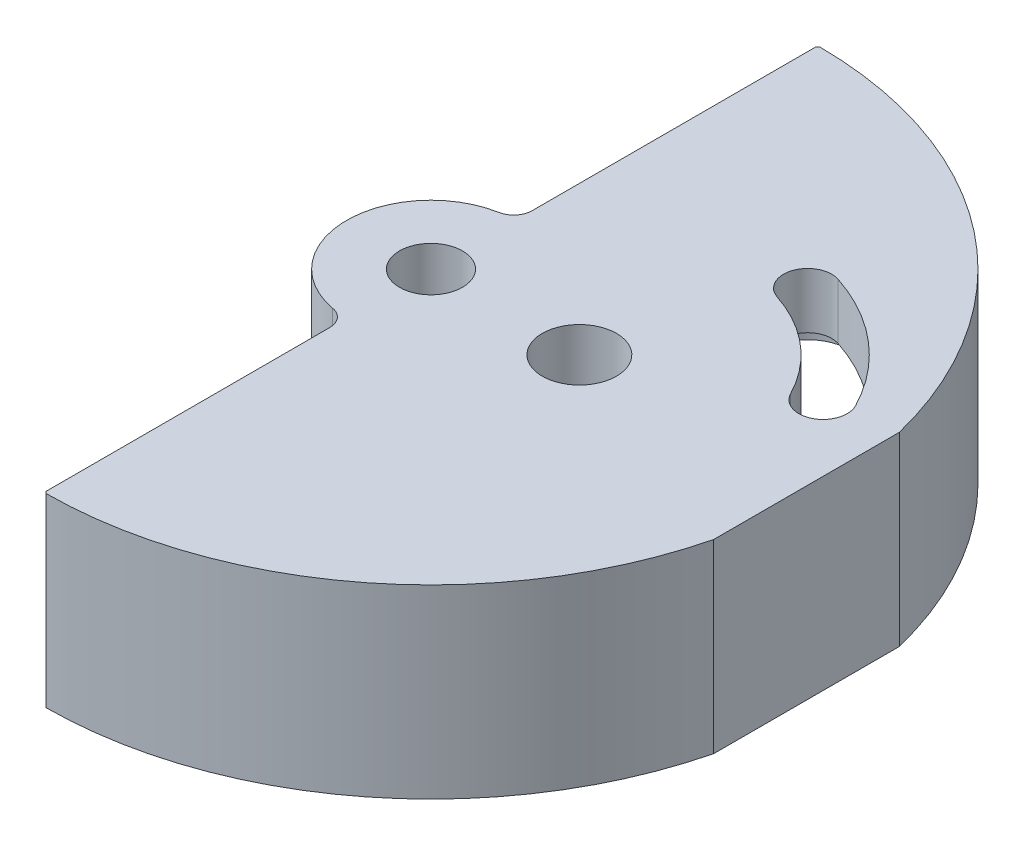
from build123d import *

# Parameters (mm, degrees)
SKETCH_1_R          = 6
EXTRUDE_1_DEPTH     = 20
SKETCH_2_R          = 6.1
EXTRUDE_2_DEPTH     = 11
SKETCH_3_R          = 3.4
CUT_EXTRUDE_1_DEPTH = 60.989832472
SKETCH_4_R          = 2.1
CUT_EXTRUDE_2_DEPTH = 10
CUT_EXTRUDE_3_DEPTH = 63.271823484
CUT_EXTRUDE_4_DEPTH = 12
SKETCH_7_R          = 6.5
CUT_EXTRUDE_5_DEPTH = 1
SKETCH_8_R          = 4
CUT_EXTRUDE_6_DEPTH = 60.554848669
CUT_EXTRUDE_7_DEPTH = 60.344586948
CUT_EXTRUDE_8_DEPTH = 2
CHAMFER_1_SIZE      = 0.2


with BuildPart() as part:
    # 草图1 → 凸台-拉伸1 (new body)
    with BuildSketch(Plane(origin=(0, 0, 0), x_dir=(1, 0, 0), z_dir=(0, 1, 0))):
        with BuildLine():
            Line((0, 41.7), (0, 10.918333206))
            ThreePointArc((0, 10.918333206), (-0.463653568, 9.637849063), (-1.63963964, 8.951065962))
            ThreePointArc((-1.63963964, 8.951065962), (-9.1, 0), (-1.63963964, -8.951065962))
            ThreePointArc((-1.63963964, -8.951065962), (-0.463653568, -9.637849063), (0, -10.918333206))
            Line((0, -10.918333206), (0, -41.7))
            ThreePointArc((0, -41.7), (41.7, 0), (0, 41.7))
        make_face()
        with Locations(Location((0, 0, 0), (0, 0, 270))):
            Circle(SKETCH_1_R, mode=Mode.SUBTRACT)
    extrude(amount=EXTRUDE_1_DEPTH)

    # 草图2 → 凸台-拉伸2 (add)
    with BuildSketch(Plane.XZ):
        Circle(SKETCH_2_R)
    extrude(amount=-EXTRUDE_2_DEPTH)

    # 草图3 → 切除-拉伸1 (cut, through all)
    with BuildSketch(Plane(origin=(0, 11, 0), x_dir=(1, 0, 0), z_dir=(0, 1, 0))):
        with Locations(Location((0, 0, 0), (0, 0, 270))):
            Circle(SKETCH_3_R)
    extrude(amount=-CUT_EXTRUDE_1_DEPTH, mode=Mode.SUBTRACT)

    # 草图4 → 切除-拉伸2 (cut)
    with BuildSketch(Plane.ZY):
        with Locations((33.667083302, 15)):
            Circle(SKETCH_4_R)
        with Locations((20.918333206, 10)):
            Circle(SKETCH_4_R)
        with Locations(Location((-33.667083302, 15, 0), (0, 0, 180))):
            Circle(SKETCH_4_R)
        with Locations(Location((-20.918333206, 10, 0), (0, 0, 180))):
            Circle(SKETCH_4_R)
    extrude(amount=-CUT_EXTRUDE_2_DEPTH, mode=Mode.SUBTRACT)


with BuildPart() as body_2:
    # 镜向1: mirrored copy
    add(part.part.mirror(Plane.ZX))

    # 草图5 → 切除-拉伸3 (cut, through all)
    with BuildSketch(Plane(origin=(0, 0, 0), x_dir=(1, 0, 0), z_dir=(0, 1, 0))):
        with BuildLine():
            Line((40.483206395, 10), (40.483206395, -10))
            ThreePointArc((40.483206395, -10), (41.394683878, -5.036878663), (41.7, 0))
            ThreePointArc((41.7, 0), (41.394683878, 5.036878663), (40.483206395, 10))
        make_face()
    extrude(amount=-CUT_EXTRUDE_3_DEPTH, mode=Mode.SUBTRACT)

    # 草图6 → 切除-拉伸4 (cut)
    with BuildSketch(Plane.XZ.offset(20)):
        with BuildLine():
            Line((6, -36.124783736), (6, -6.841783393))
            ThreePointArc((6, -6.841783393), (9.1, 0), (6, 6.841783393))
            Line((6, 6.841783393), (6, 36.124783736))
            ThreePointArc((6, 36.124783736), (6.747974614, 37.684409471), (8.432432432, 38.077474749))
            ThreePointArc((8.432432432, 38.077474749), (39, 0), (8.432432432, -38.077474749))
            ThreePointArc((8.432432432, -38.077474749), (6.747974614, -37.684409471), (6, -36.124783736))
        make_face()
    extrude(amount=-CUT_EXTRUDE_4_DEPTH, mode=Mode.SUBTRACT)

    # 草图7 → 切除-拉伸5 (cut)
    with BuildSketch(Plane.XZ.offset(8)):
        with Locations(Location((16, 0, 0), (0, 0, 270))):
            Circle(SKETCH_7_R)
    extrude(amount=-CUT_EXTRUDE_5_DEPTH, mode=Mode.SUBTRACT)

    # 草图8 → 切除-拉伸6 (cut, through all)
    with BuildSketch(Plane.XZ.offset(7)):
        with Locations(Location((16, 0, 0), (0, 0, 270))):
            Circle(SKETCH_8_R)
    extrude(amount=-CUT_EXTRUDE_6_DEPTH, mode=Mode.SUBTRACT)

    # 草图9 → 切除-拉伸7 (cut, through all)
    with BuildSketch(Plane.XZ.offset(8)):
        with BuildLine():
            ThreePointArc((22.891243611, -20.998113284), (30.339314214, -16.81648203), (35.645345475, -10.122766478))
            ThreePointArc((35.645345475, -10.122766478), (34.525042064, -6.62063566), (31.022911246, -7.740939071))
            ThreePointArc((31.022911246, -7.740939071), (26.965357928, -12.859662729), (21.269774526, -16.057380747))
            ThreePointArc((21.269774526, -16.057380747), (19.6101428, -19.338481558), (22.891243611, -20.998113284))
        make_face()
    extrude(amount=-CUT_EXTRUDE_7_DEPTH, mode=Mode.SUBTRACT)

    # 草图10 → 切除-拉伸8 (cut)
    with BuildSketch(Plane.XZ.offset(8)):
        with BuildLine():
            ThreePointArc((23.712726546, -22.721297552), (31.438040853, -18.105017627), (37.217069697, -11.206224463))
            ThreePointArc((37.217069697, -11.206224463), (35.608500049, -5.048911438), (29.451187024, -6.657481086))
            ThreePointArc((29.451187024, -6.657481086), (25.598501128, -11.256676528), (20.44829159, -14.334196479))
            ThreePointArc((20.44829159, -14.334196479), (17.886958532, -20.159964494), (23.712726546, -22.721297552))
        make_face()
    extrude(amount=-CUT_EXTRUDE_8_DEPTH, mode=Mode.SUBTRACT)

    # 倒角1
    chamfer_1_edges = [body_2.edges().sort_by_distance(p)[0] for p in [
        (0, -10, 41.7),
        (0, -10, -41.7),
    ]]
    chamfer(chamfer_1_edges, length=CHAMFER_1_SIZE)


solid = body_2.part
